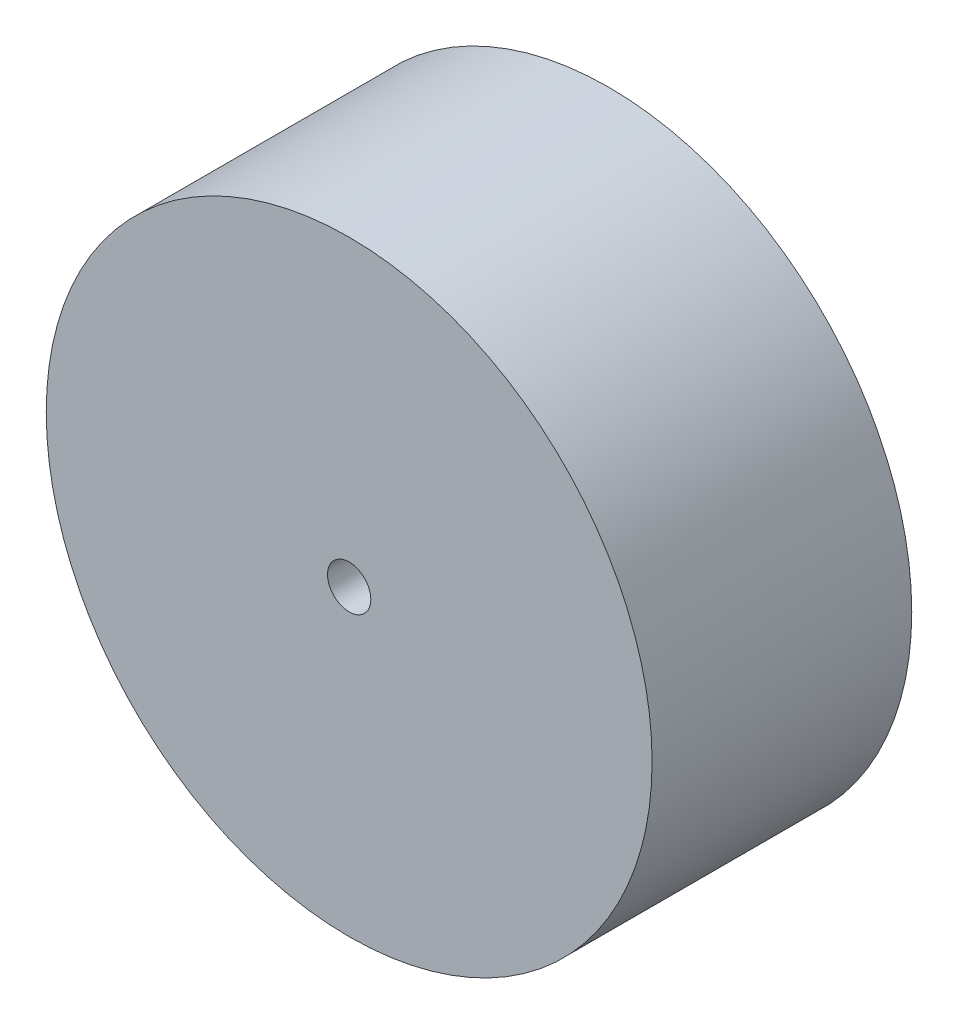
from build123d import *

# Parameters (mm, degrees)
SKETCH1_R           = 35.56
BOSS_EXTRUDE1_DEPTH = 30.48
SKETCH2_R           = 2.54
CUT_EXTRUDE1_DEPTH  = 30.48


with BuildPart() as part:
    # Sketch1 → Boss-Extrude1 (new body)
    with BuildSketch(Plane.XY):
        with Locations(Location((0, 0, 0), (0, 0, 180))):
            Circle(SKETCH1_R)
    extrude(amount=BOSS_EXTRUDE1_DEPTH)

    # Sketch2 → Cut-Extrude1 (cut)
    with BuildSketch(Plane.XY.offset(30.48)):
        Circle(SKETCH2_R)
    extrude(amount=-CUT_EXTRUDE1_DEPTH, mode=Mode.SUBTRACT)


solid = part.part
